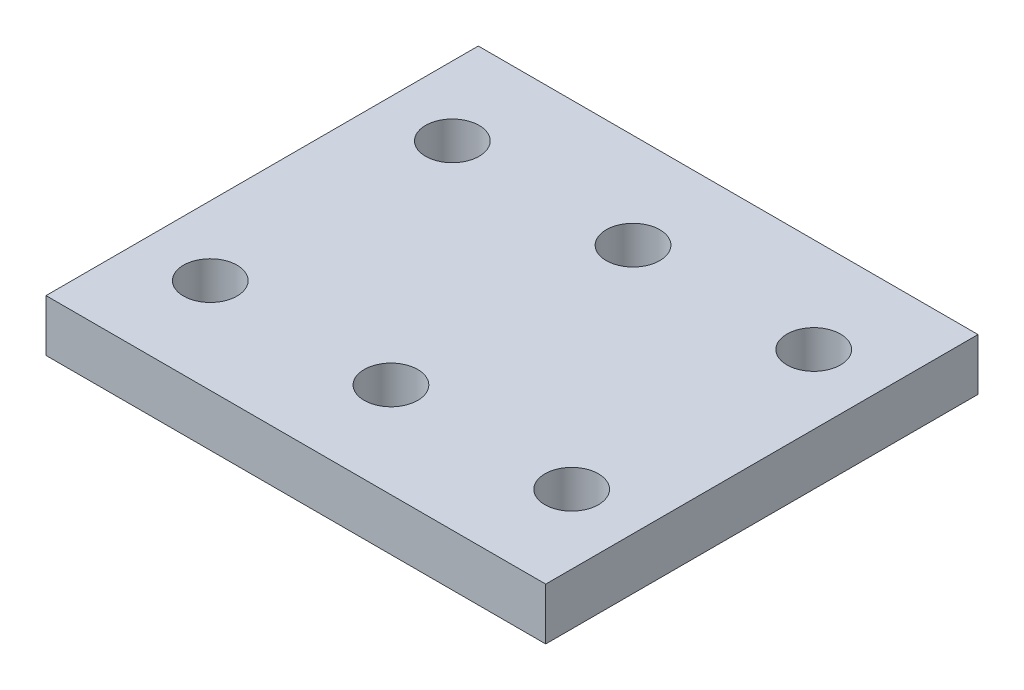
from build123d import *

# Parameters (mm, degrees)
SKETCH_1_W      = 28.9
SKETCH_1_H      = 25
SKETCH_1_R      = 1.55
EXTRUDE_1_DEPTH = 3


with BuildPart() as part:
    # 草图1 → 凸台-拉伸1 (new body)
    with BuildSketch(Plane(origin=(0, 0, 0), x_dir=(1, 0, 0), z_dir=(0, 1, 0))):
        Rectangle(SKETCH_1_W, SKETCH_1_H)
        with Locations(Location((10.45, 7, 0), (0, 0, 270))):
            Circle(SKETCH_1_R, mode=Mode.SUBTRACT)
        with Locations(Location((10.45, -7, 0), (0, 0, 270))):
            Circle(SKETCH_1_R, mode=Mode.SUBTRACT)
        with Locations(Location((-10.45, -7, 0), (0, 0, 270))):
            Circle(SKETCH_1_R, mode=Mode.SUBTRACT)
        with Locations(Location((-10.45, 7, 0), (0, 0, 270))):
            Circle(SKETCH_1_R, mode=Mode.SUBTRACT)
        with Locations(Location((0, 7, 0), (0, 0, 270))):
            Circle(SKETCH_1_R, mode=Mode.SUBTRACT)
        with Locations(Location((0, -7, 0), (0, 0, 270))):
            Circle(SKETCH_1_R, mode=Mode.SUBTRACT)
    extrude(amount=EXTRUDE_1_DEPTH)


solid = part.part
